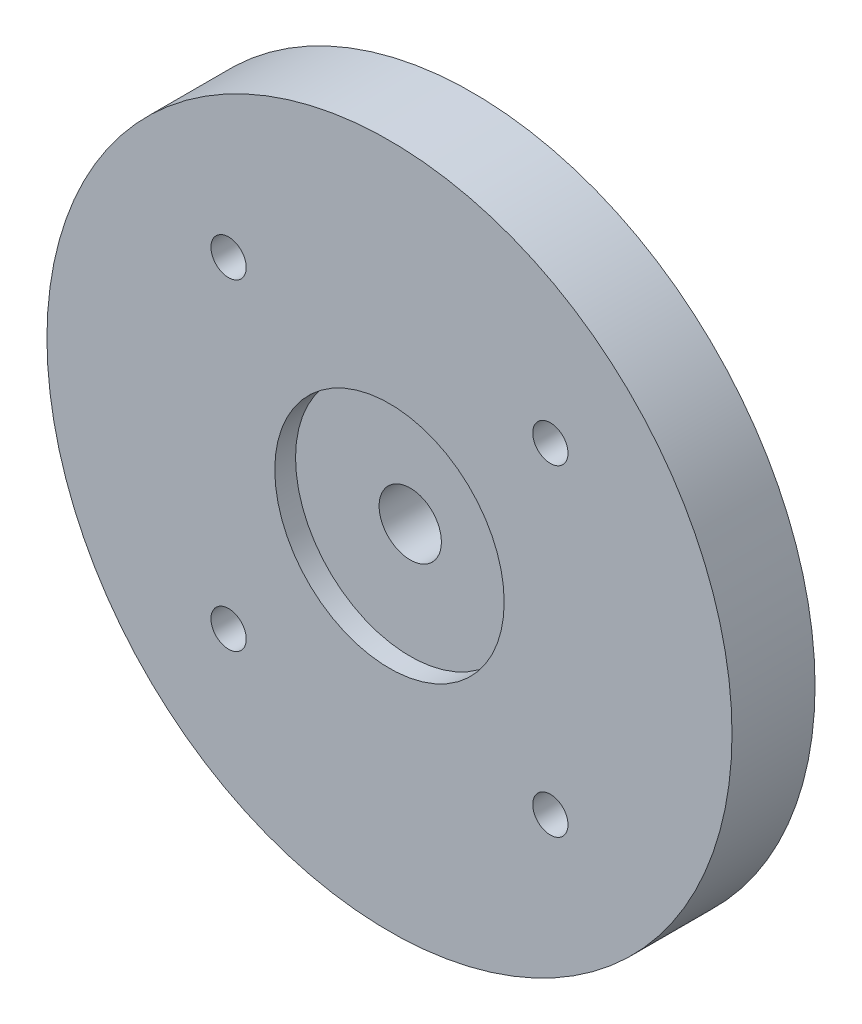
from build123d import *

# Parameters (mm, degrees)
SKETCH2_R               = 33
BOSS_EXTRUDE1_DEPTH     = 8
SKETCH6_R               = 10
BOSS_EXTRUDE2_DEPTH     = 2
CUT_EXTRUDE1_DEPTH      = 48.728398255
CUT_EXTRUDE1_DEPTH_BACK = 48.728398255
SKETCH3_R               = 1.7
SKETCH3_R_2             = 3
CUT_EXTRUDE2_DEPTH      = 48.349762407
CUT_EXTRUDE2_DEPTH_BACK = 2
SKETCH4_R               = 2.8
SKETCH5_R               = 2.1
CUT_EXTRUDE3_DEPTH      = 6
FILLET1_R               = 1
SKETCH7_R               = 11.05
CUT_EXTRUDE4_DEPTH      = 2


with BuildPart() as part:
    # Sketch2 → Boss-Extrude1 (new body)
    with BuildSketch(Plane.XY):
        Circle(SKETCH2_R)
    extrude(amount=BOSS_EXTRUDE1_DEPTH)

    # Sketch6 → Boss-Extrude2 (add)
    with BuildSketch(Plane(origin=(0, 0, 0), x_dir=(-1, 0, 0), z_dir=(0, 0, -1))):
        Circle(SKETCH6_R)
    extrude(amount=BOSS_EXTRUDE2_DEPTH)

    # Sketch3 → Cut-Extrude1 (cut, two sides: drawn at the far end of the back side and taken through both)
    with BuildSketch(Plane.XY.offset(8).offset(-CUT_EXTRUDE1_DEPTH_BACK)):
        with Locations((-15.5, 15.5)):
            Circle(SKETCH3_R)
        with Locations((15.5, 15.5)):
            Circle(SKETCH3_R)
        with Locations((15.5, -15.5)):
            Circle(SKETCH3_R)
        with Locations((-15.5, -15.5)):
            Circle(SKETCH3_R)
        Circle(SKETCH3_R_2)
    extrude(amount=CUT_EXTRUDE1_DEPTH + CUT_EXTRUDE1_DEPTH_BACK, mode=Mode.SUBTRACT)

    # Sketch4 → Cut-Extrude2 (cut, two sides: drawn at the far end of the back side and taken through both)
    with BuildSketch(Plane(origin=(0, 0, 0), x_dir=(-1, 0, 0), z_dir=(0, 0, -1)).offset(-CUT_EXTRUDE2_DEPTH_BACK)):
        with Locations(Location((-15.5, 15.5, 0), (0, 0, 180))):
            Circle(SKETCH4_R)
        with Locations(Location((15.5, 15.5, 0), (0, 0, 180))):
            Circle(SKETCH4_R)
        with Locations(Location((15.5, -15.5, 0), (0, 0, 180))):
            Circle(SKETCH4_R)
        with Locations(Location((-15.5, -15.5, 0), (0, 0, 180))):
            Circle(SKETCH4_R)
    extrude(amount=CUT_EXTRUDE2_DEPTH + CUT_EXTRUDE2_DEPTH_BACK, mode=Mode.SUBTRACT)

    # Sketch5 → Cut-Extrude3 (cut)
    with BuildSketch(Plane(origin=(0, 0, 0), x_dir=(-1, 0, 0), z_dir=(0, 0, -1))):
        with Locations((0, 29.5)):
            Circle(SKETCH5_R)
        with Locations((29.5, 0)):
            Circle(SKETCH5_R)
        with Locations((0, -29.5)):
            Circle(SKETCH5_R)
        with Locations((-29.5, 0)):
            Circle(SKETCH5_R)
    extrude(amount=-CUT_EXTRUDE3_DEPTH, mode=Mode.SUBTRACT)

    # Fillet1
    fillet1_edges = [part.edges().sort_by_distance(p)[0] for p in [
        (10, 0, 0),
    ]]
    fillet(fillet1_edges, radius=FILLET1_R)

    # Sketch7 → Cut-Extrude4 (cut)
    with BuildSketch(Plane.XY.offset(8)):
        Circle(SKETCH7_R)
    extrude(amount=-CUT_EXTRUDE4_DEPTH, mode=Mode.SUBTRACT)


solid = part.part
